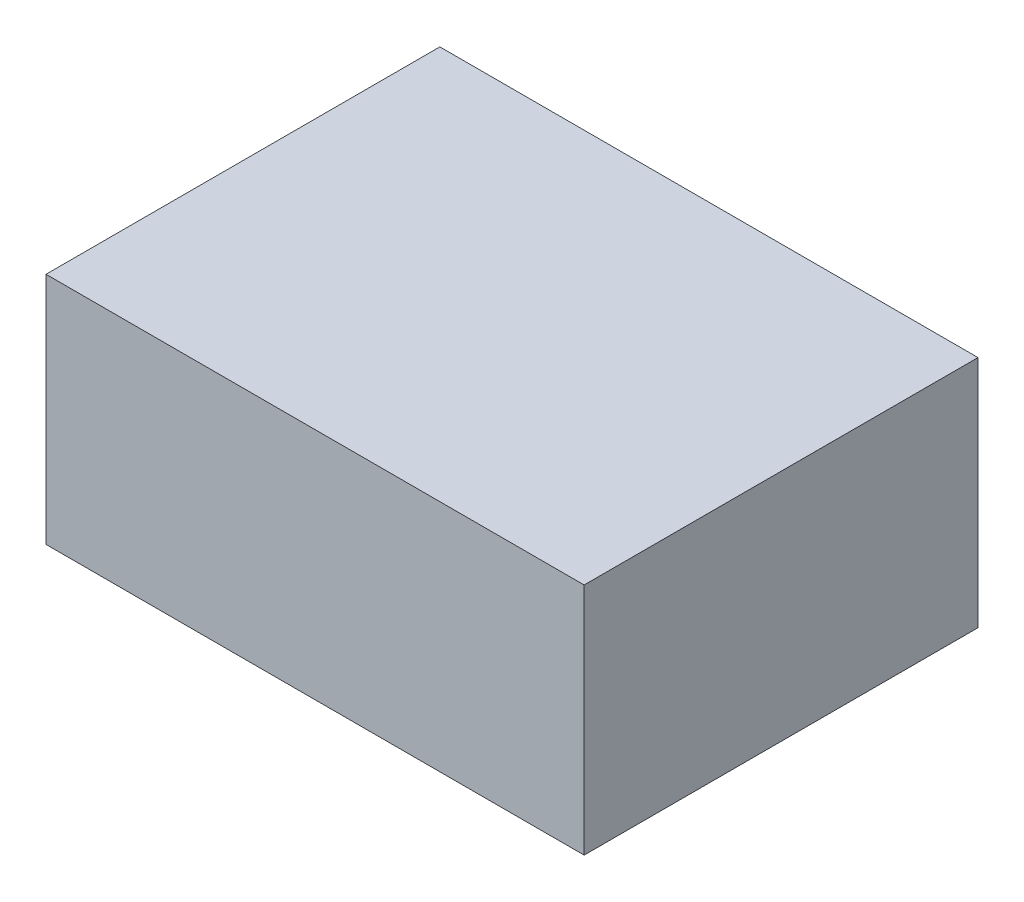
from build123d import *

# Parameters (mm, degrees)
SKETCH1_W           = 6.9
SKETCH1_H           = 5.05
BOSS_EXTRUDE1_DEPTH = 3


with BuildPart() as part:
    # Sketch1 → Boss-Extrude1 (new body)
    with BuildSketch(Plane(origin=(0, 0, 0), x_dir=(1, 0, 0), z_dir=(0, 1, 0))):
        Rectangle(SKETCH1_W, SKETCH1_H)
    extrude(amount=BOSS_EXTRUDE1_DEPTH)


solid = part.part
